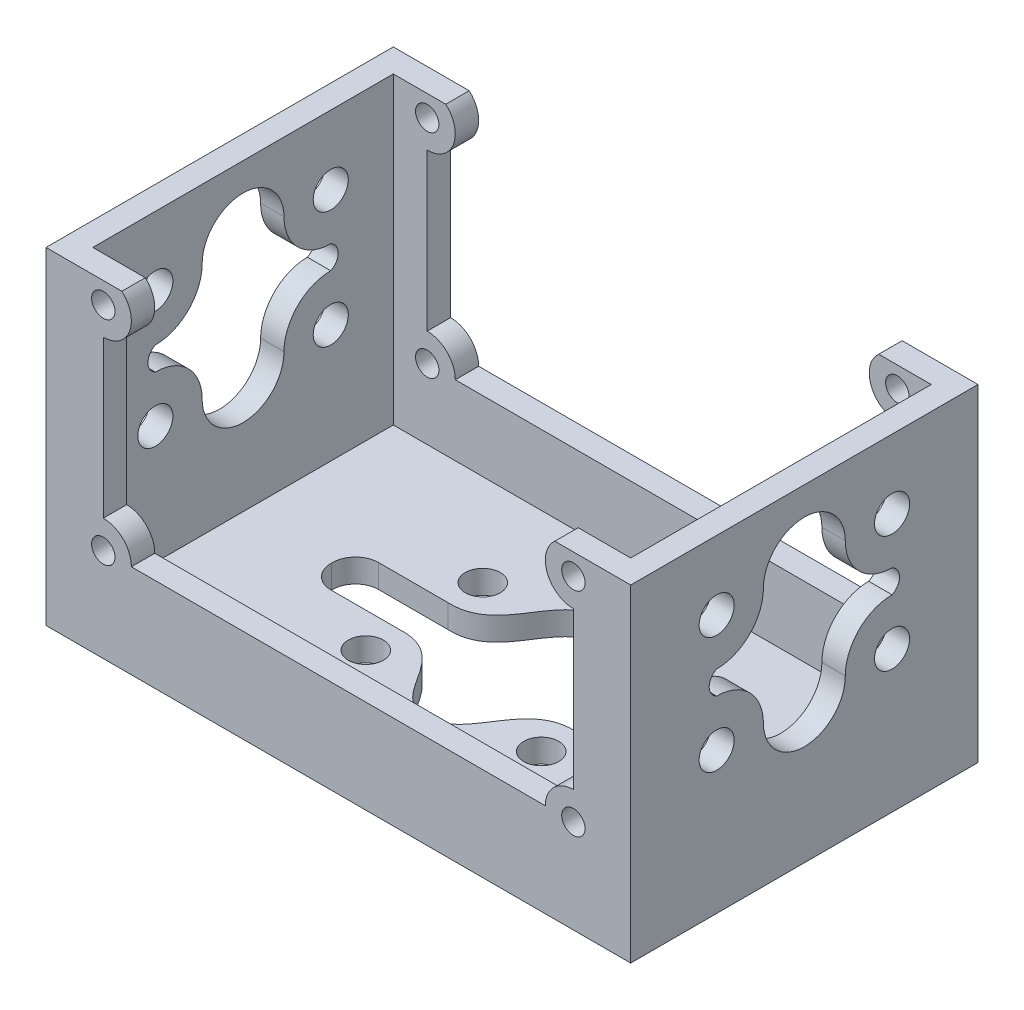
from build123d import *

# Parameters (mm, degrees)
SKETCH_1_W          = 50
SKETCH_1_H          = 29.7
EXTRUDE_1_DEPTH     = 2
SKETCH_2_W          = 50
SKETCH_2_H          = 29.7
SKETCH_2_W_2        = 46
SKETCH_2_H_2        = 25.7
EXTRUDE_2_DEPTH     = 26
SKETCH_4_R          = 1.5
CUT_EXTRUDE_2_DEPTH = 2
SKETCH_5_R          = 1.5
CUT_EXTRUDE_3_DEPTH = 2
SKETCH_3_R          = 1
CUT_EXTRUDE_5_DEPTH = 2


with BuildPart() as part:
    # 草图1 → 凸台-拉伸1 (new body)
    with BuildSketch(Plane(origin=(0, 0, 0), x_dir=(1, 0, 0), z_dir=(0, 1, 0))):
        Rectangle(SKETCH_1_W, SKETCH_1_H)
    extrude(amount=EXTRUDE_1_DEPTH)

    # 草图2 → 凸台-拉伸2 (add)
    with BuildSketch(Plane(origin=(0, 2, 0), x_dir=(1, 0, 0), z_dir=(0, 1, 0))):
        Rectangle(SKETCH_2_W, SKETCH_2_H)
        Rectangle(SKETCH_2_W_2, SKETCH_2_H_2, mode=Mode.SUBTRACT)
    extrude(amount=EXTRUDE_2_DEPTH)

    # 草图4 → 切除-拉伸2 (cut)
    with BuildSketch(Plane(origin=(25, 0, 0), x_dir=(0, 0, -1), z_dir=(1, 0, 0))):
        with Locations((-7.5, 12.1)):
            Circle(SKETCH_4_R)
        with Locations((-7.5, 22.1)):
            Circle(SKETCH_4_R)
        with Locations(Location((7.5, 12.1, 0), (0, 0, 180))):
            Circle(SKETCH_4_R)
        with Locations(Location((7.5, 22.1, 0), (0, 0, 180))):
            Circle(SKETCH_4_R)
        with BuildLine():
            ThreePointArc((-7.5, 18.1), (-4.671572875, 19.271572875), (-3.5, 22.1))
            ThreePointArc((-3.5, 22.1), (0, 25.6), (3.5, 22.1))
            ThreePointArc((3.5, 22.1), (4.671572875, 19.271572875), (7.5, 18.1))
            ThreePointArc((7.5, 18.1), (8.135409658, 17.1), (7.5, 16.1))
            ThreePointArc((7.5, 16.1), (4.671572875, 14.928427125), (3.5, 12.1))
            ThreePointArc((3.5, 12.1), (0, 8.6), (-3.5, 12.1))
            ThreePointArc((-3.5, 12.1), (-4.671572875, 14.928427125), (-7.5, 16.1))
            ThreePointArc((-7.5, 16.1), (-8.135409658, 17.1), (-7.5, 18.1))
        make_face()
    cut_extrude_2 = extrude(amount=-CUT_EXTRUDE_2_DEPTH, mode=Mode.SUBTRACT)

    # 镜向2: 切除-拉伸2 across plane
    add(cut_extrude_2.mirror(Plane(origin=(0, 0, 0), x_dir=(0, 0, 1), z_dir=(1, 0, 0))), mode=Mode.SUBTRACT)

    # 草图5 → 切除-拉伸3 (cut)
    with BuildSketch(Plane.XZ):
        with Locations(Location((7.5, 5, 0), (0, 0, 270))):
            Circle(SKETCH_5_R)
        with Locations(Location((7.5, -5, 0), (0, 0, 90))):
            Circle(SKETCH_5_R)
        with Locations(Location((-7.5, -5, 0), (0, 0, 270))):
            Circle(SKETCH_5_R)
        with Locations(Location((-7.5, 5, 0), (0, 0, 90))):
            Circle(SKETCH_5_R)
        with BuildLine():
            Line((7.5, 2.033504468), (13.445752083, 2.033504468))
            ThreePointArc((13.445752083, 2.033504468), (14.861299313, 1.433919229), (15.415512326, 0))
            ThreePointArc((15.415512326, 0), (14.861299313, -1.433919229), (13.445752083, -2.033504468))
            Line((13.445752083, -2.033504468), (7.5, -2.033504468))
            add(Edge.make_bspline(
                [(0, -7.23012785), (3.34126485, -7.578100632), (3.029788905, -1.842013201), (7.5, -2.033504468)],
                knots=[0, 0, 0, 0, 1, 1, 1, 1], degree=3))
            add(Edge.make_bspline(
                [(0, -7.23012785), (-3.34126485, -7.578100632), (-3.029788905, -1.842013201), (-7.5, -2.033504468)],
                knots=[0, 0, 0, 0, 1, 1, 1, 1], degree=3))
            Line((-7.5, -2.033504468), (-13.445752083, -2.033504468))
            ThreePointArc((-13.445752083, -2.033504468), (-14.861299313, -1.433919229), (-15.415512326, 0))
            ThreePointArc((-15.415512326, 0), (-14.861299313, 1.433919229), (-13.445752083, 2.033504468))
            Line((-13.445752083, 2.033504468), (-7.5, 2.033504468))
            add(Edge.make_bspline(
                [(0, 7.23012785), (-3.34126485, 7.578100632), (-3.029788905, 1.842013201), (-7.5, 2.033504468)],
                knots=[0, 0, 0, 0, 1, 1, 1, 1], degree=3))
            add(Edge.make_bspline(
                [(0, 7.23012785), (3.34126485, 7.578100632), (3.029788905, 1.842013201), (7.5, 2.033504468)],
                knots=[0, 0, 0, 0, 1, 1, 1, 1], degree=3))
        make_face()
    extrude(amount=-CUT_EXTRUDE_3_DEPTH, mode=Mode.SUBTRACT)

    # 草图3 → 切除-拉伸5 (cut)
    with BuildSketch(Plane.XY.offset(14.85)):
        with BuildLine():
            ThreePointArc((-20.1, 10.4), (-18.402943725, 9.697056275), (-17.7, 8))
            Line((-17.7, 8), (17.7, 8))
            ThreePointArc((17.7, 8), (18.402943725, 9.697056275), (20.1, 10.4))
            Line((20.1, 10.4), (20.1, 23.8))
            ThreePointArc((20.1, 23.8), (17.855005568, 25.351471863), (18.512549213, 28))
            Line((18.512549213, 28), (-18.512549213, 28))
            ThreePointArc((-18.512549213, 28), (-17.855005568, 25.351471863), (-20.1, 23.8))
            Line((-20.1, 23.8), (-20.1, 10.4))
        make_face()
        with Locations((-20.1, 8)):
            Circle(SKETCH_3_R)
        with Locations((20.1, 8)):
            Circle(SKETCH_3_R)
        with Locations((20.1, 26.2)):
            Circle(SKETCH_3_R)
        with Locations((-20.1, 26.2)):
            Circle(SKETCH_3_R)
    cut_extrude_5 = extrude(amount=-CUT_EXTRUDE_5_DEPTH, mode=Mode.SUBTRACT)

    # 镜向4: 切除-拉伸5 across plane
    add(cut_extrude_5.mirror(Plane.XY), mode=Mode.SUBTRACT)


solid = part.part
